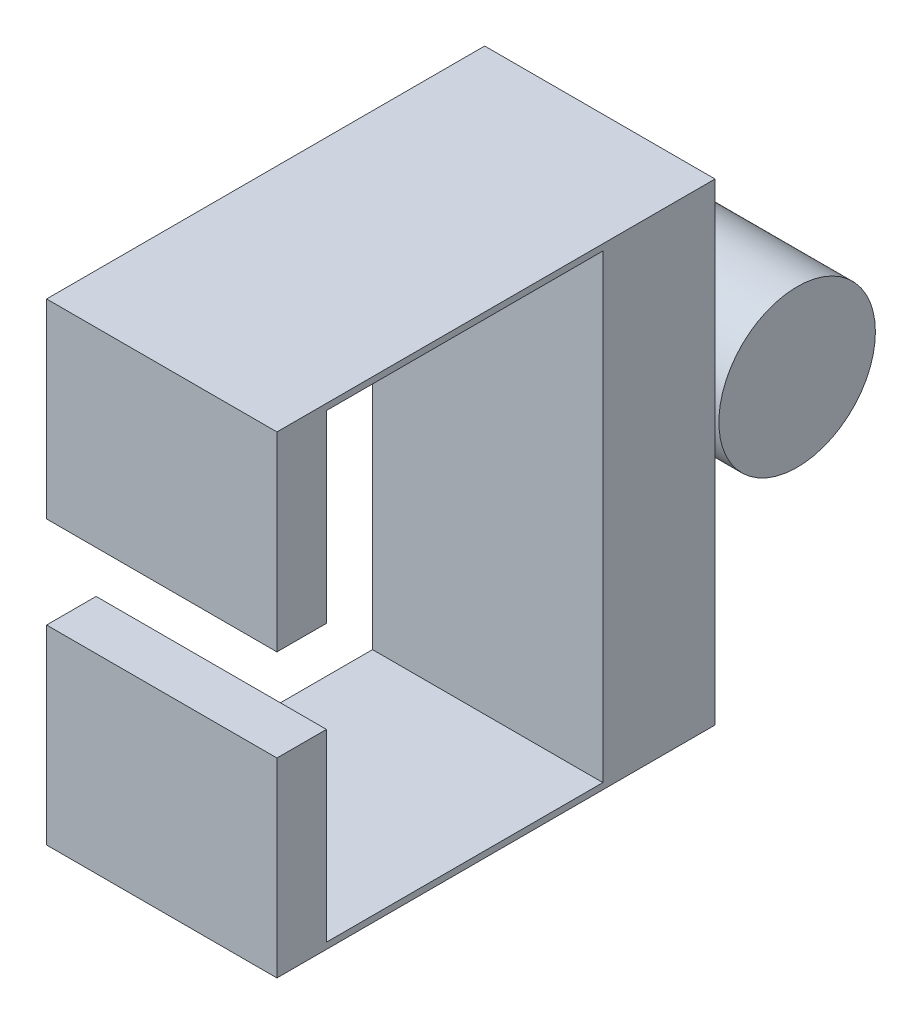
from build123d import *

# Parameters (mm, degrees)
SKETCH1_R           = 10.789707568
BOSS_EXTRUDE1_DEPTH = 25.4
BOSS_EXTRUDE2_DEPTH = 3.056759297
SKETCH3_W           = 31.75
SKETCH3_H           = 65.18759886
BOSS_EXTRUDE3_DEPTH = 15.463355349
SKETCH4_W           = 31.75
SKETCH4_H           = 0.86411943
BOSS_EXTRUDE4_DEPTH = 44.925321362
SKETCH5_W           = 31.75
SKETCH5_H           = 6.825321362
BOSS_EXTRUDE5_DEPTH = 25.4


with BuildPart() as part:
    # Sketch1 → Boss-Extrude1 (new body)
    with BuildSketch(Plane.YZ):
        Circle(SKETCH1_R)
    extrude(amount=BOSS_EXTRUDE1_DEPTH)

    # Sketch2 → Boss-Extrude2 (add)
    with BuildSketch(Plane(origin=(0, 0, 0), x_dir=(0, -1, 0), z_dir=(-1, 0, 0))):
        with BuildLine():
            Line((2.54, -10.789707568), (-2.54, -10.789707568))
            ThreePointArc((-2.54, -10.789707568), (-9.724204897, -7.813912465), (-12.7, -0.629707568))
            Line((-12.7, -0.629707568), (-12.7, 14.610292432))
            Line((-12.7, 14.610292432), (12.7, 14.610292432))
            Line((12.7, 14.610292432), (12.7, -0.629707568))
            ThreePointArc((12.7, -0.629707568), (9.724204897, -7.813912465), (2.54, -10.789707568))
        make_face()
    extrude(amount=BOSS_EXTRUDE2_DEPTH)

    # Sketch3 → Boss-Extrude3 (add)
    with BuildSketch(Plane.XY.offset(14.610292432)):
        with Locations((12.818240703, 0)):
            Rectangle(SKETCH3_W, SKETCH3_H)
    extrude(amount=BOSS_EXTRUDE3_DEPTH)


with BuildPart() as body_2:
    # Sketch4 → Boss-Extrude4 (new body)
    with BuildSketch(Plane.XY.offset(30.073647781)):
        with Locations((12.818240703, 32.161739715)):
            Rectangle(SKETCH4_W, SKETCH4_H)
    extrude(amount=BOSS_EXTRUDE4_DEPTH)

    # Sketch5 → Boss-Extrude5 (add)
    with BuildSketch(Plane.XZ.offset(-31.72968)):
        with Locations((12.818240703, 71.586308462)):
            Rectangle(SKETCH5_W, SKETCH5_H)
    extrude(amount=BOSS_EXTRUDE5_DEPTH)


with BuildPart() as body_3:
    # Mirror1: mirrored copy
    add(body_2.part.mirror(Plane.ZX))


with BuildPart() as body_2_1:
    add(body_2.part)

    # Combine1: union part, body 3
    add(part.part)
    add(body_3.part)


solid = body_2_1.part
